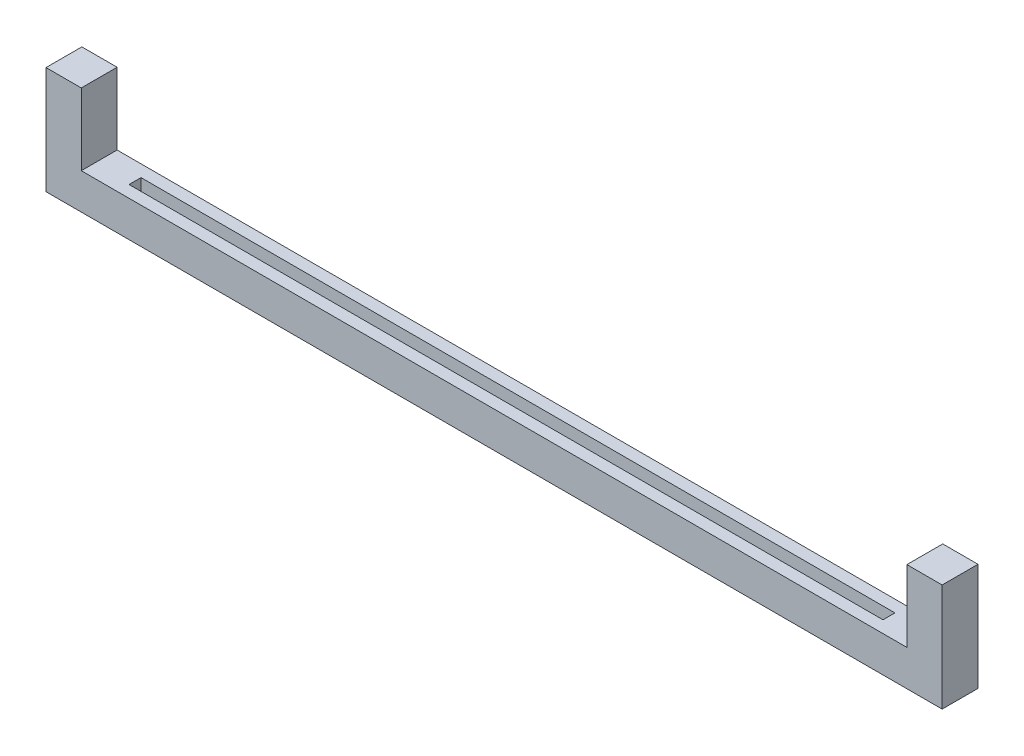
from build123d import *

# Parameters (mm, degrees)
SKETCH1_W              = 125
SKETCH1_H              = 15
SKETCH1_W_2            = 115.16
SKETCH1_H_2            = 5
SLIDER_MAIN_BODY_DEPTH = 5
SKETCH5_W              = 105.16
SKETCH5_H              = 1.666666666
CUT_EXTRUDE1_DEPTH     = 65.468984791
SKETCH6_W              = 115.16
SKETCH6_H              = 5
CUT_EXTRUDE2_DEPTH     = 64.146654702


with BuildPart() as part:
    # Sketch1 → Slider Main Body (new body)
    with BuildSketch(Plane.XY):
        Rectangle(SKETCH1_W, SKETCH1_H)
        Rectangle(SKETCH1_W_2, SKETCH1_H_2, mode=Mode.SUBTRACT)
    extrude(amount=SLIDER_MAIN_BODY_DEPTH)

    # Sketch5 → Cut-Extrude1 (cut, through all)
    with BuildSketch(Plane.XZ.offset(7.5)):
        with Locations((0, 2.5)):
            Rectangle(SKETCH5_W, SKETCH5_H)
    extrude(amount=-CUT_EXTRUDE1_DEPTH, mode=Mode.SUBTRACT)

    # Sketch6 → Cut-Extrude2 (cut, through all)
    with BuildSketch(Plane.XY.offset(5)):
        with Locations((0, 5)):
            Rectangle(SKETCH6_W, SKETCH6_H)
    extrude(amount=-CUT_EXTRUDE2_DEPTH, mode=Mode.SUBTRACT)


solid = part.part
